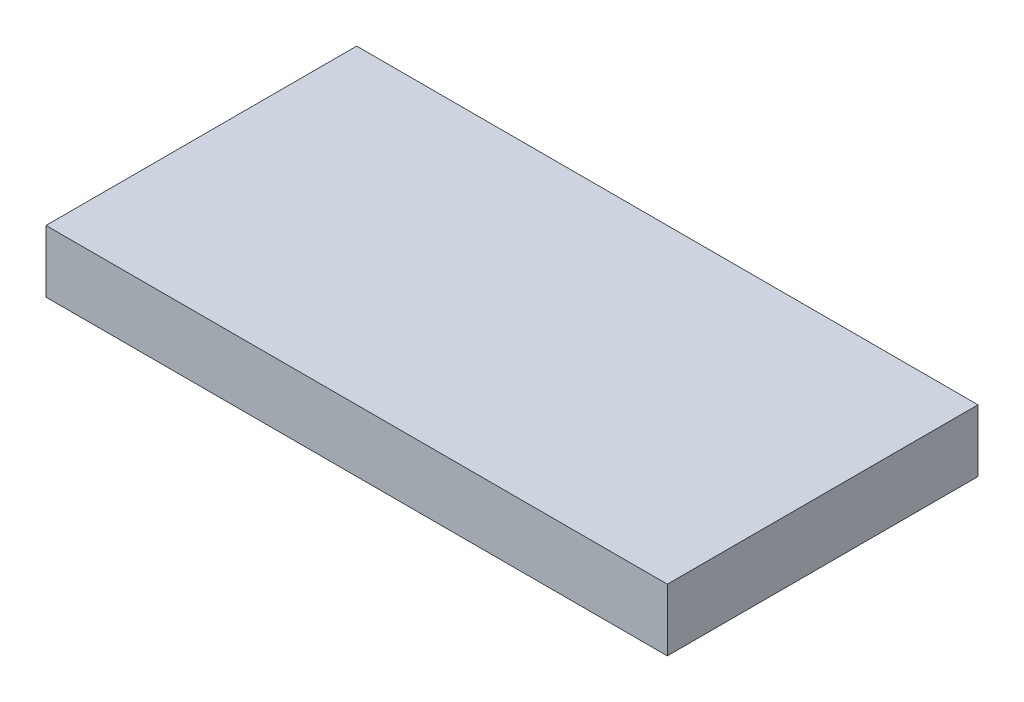
from build123d import *

# Parameters (mm, degrees)
SKETCH1_W           = 40
SKETCH1_H           = 20
BOSS_EXTRUDE1_DEPTH = 4


with BuildPart() as part:
    # Sketch1 → Boss-Extrude1 (new body)
    with BuildSketch(Plane(origin=(0, 0, 0), x_dir=(1, 0, 0), z_dir=(0, 1, 0))):
        with Locations((20, 10)):
            Rectangle(SKETCH1_W, SKETCH1_H)
    extrude(amount=BOSS_EXTRUDE1_DEPTH)


solid = part.part
